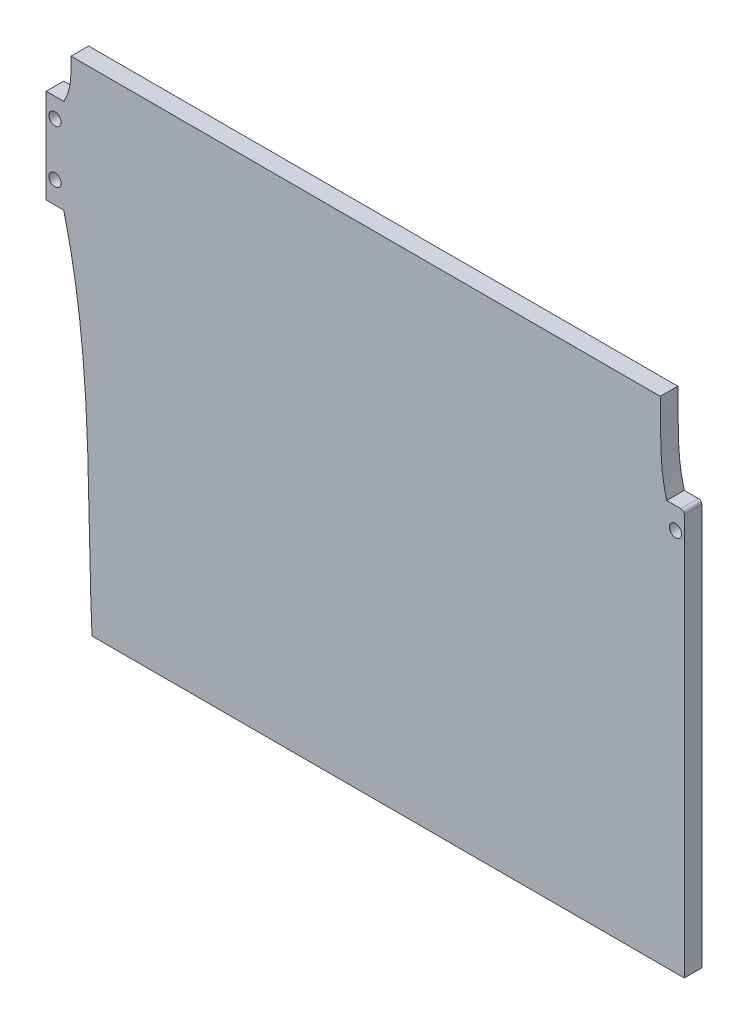
from build123d import *

# Parameters (mm, degrees)
SKETCH1_R           = 1.75
BOSS_EXTRUDE1_DEPTH = 5


with BuildPart() as part:
    # Sketch1 → Boss-Extrude1 (new body)
    with BuildSketch(Plane.XY):
        with BuildLine():
            Line((-93.75, -249.14706128), (-98.75, -249.14706128))
            Line((-98.75, -249.14706128), (-98.75, -275.963602955))
            Line((-98.75, -275.963602955), (-93.75, -275.963602955))
            add(Edge.make_bspline(
                [(-93.75, -275.963602955), (-85.328784133, -309.023467032), (-87.242655609, -343.164760507), (-85.696102167, -376.929671114)],
                knots=[0, 0, 0, 0, 1, 1, 1, 1], degree=3))
            Line((-85.696102167, -376.929671114), (82.9, -376.929671114))
            add(Edge.make_bspline(
                [(82.9, -274.035506052), (82.9, -308.333561073), (82.9, -342.631616093), (82.9, -376.929671114)],
                knots=[0, 0, 0, 0, 1, 1, 1, 1], degree=3))
            Line((82.9, -274.035506052), (82.9, -262.713680137))
            ThreePointArc((82.9, -262.713680137), (82.607106781, -262.006573355), (81.9, -261.713680137))
            Line((81.9, -261.713680137), (77.9, -261.713680137))
            add(Edge.make_bspline(
                [(77.9, -261.713680137), (75.588198468, -253.598889885), (76.340151595, -245.239667724), (76.055808767, -236.957982208)],
                knots=[0, 0, 0, 0, 1, 1, 1, 1], degree=3))
            Line((76.055808767, -236.957982208), (-91.666234566, -236.957982208))
            add(Edge.make_bspline(
                [(-93.75, -249.14706128), (-91.542697993, -245.516719889), (-91.581655695, -241.056968833), (-91.666234566, -236.957982208)],
                knots=[0, 0, 0, 0, 1, 1, 1, 1], degree=3))
        make_face()
        with Locations((-96.249351551, -269.713963286)):
            Circle(SKETCH1_R, mode=Mode.SUBTRACT)
        with Locations((-96.243654126, -254.713964368)):
            Circle(SKETCH1_R, mode=Mode.SUBTRACT)
        with Locations((80.4, -267.874593094)):
            Circle(SKETCH1_R, mode=Mode.SUBTRACT)
    extrude(amount=BOSS_EXTRUDE1_DEPTH)


solid = part.part
